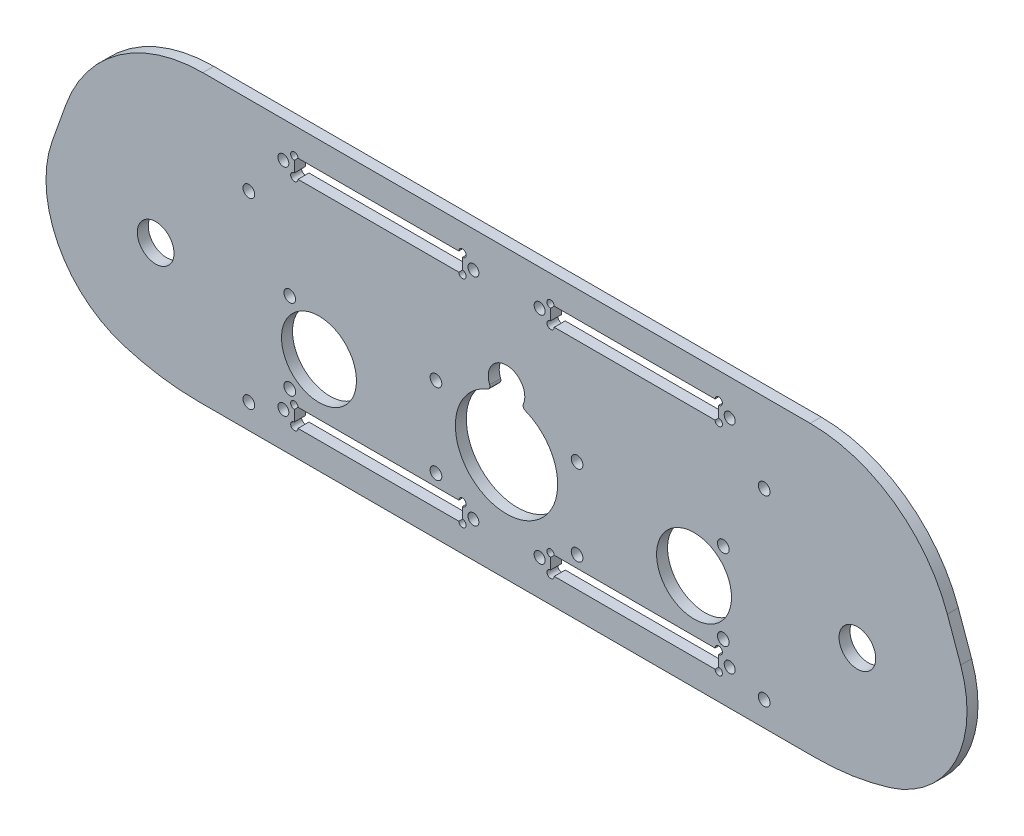
from build123d import *

# Parameters (mm, degrees)
SKETCH_1_R               = 5.025
EXTRUDE_1_DEPTH          = 3
SKETCH_2_R               = 1.6
SKETCH_2_R_2             = 10.25
SKETCH_2_R_3             = 14
CUT_EXTRUDE_1_DEPTH      = 130.55693729
EXTRUDE_START            = -3
EXTRUDE_2_DEPTH          = 3
SKETCH_3_R               = 1.5
SKETCH_3_W               = 46
SKETCH_3_H               = 5
CUT_EXTRUDE_2_DEPTH      = 135.433749111
CUT_EXTRUDE_3_DEPTH      = 135.433749111
CUT_EXTRUDE_3_DEPTH_BACK = 135.433749111
SKETCH_5_R               = 1
SKETCH_6_R               = 5
CUT_EXTRUDE_5_DEPTH      = 135.433749111
FILLET_1_R               = 1


with BuildPart() as part:
    # ｽｹｯﾁ1 → ﾎﾞｽ - 押し出し1 (new body)
    with BuildSketch(Plane.XY):
        with BuildLine():
            Line((96, -30), (-96, -30))
            ThreePointArc((-96, -30), (-126, 0), (-96, 30))
            Line((-96, 30), (96, 30))
            ThreePointArc((96, 30), (126, 0), (96, -30))
        make_face()
        with Locations((-96, 0)):
            Circle(SKETCH_1_R, mode=Mode.SUBTRACT)
        with Locations((96, 0)):
            Circle(SKETCH_1_R, mode=Mode.SUBTRACT)
    extrude(amount=EXTRUDE_1_DEPTH)

    # ｽｹｯﾁ2 → ｶｯﾄ - 押し出し1 (cut, through all)
    with BuildSketch(Plane.XY.offset(3)):
        with Locations((-59.307299254, 5.75)):
            Circle(SKETCH_2_R)
        with Locations((-59.307299254, -16.25)):
            Circle(SKETCH_2_R)
        with Locations((-19.307299254, -16.25)):
            Circle(SKETCH_2_R)
        with Locations((-19.307299254, 5.75)):
            Circle(SKETCH_2_R)
        with Locations(Location((19.307299254, 5.75, 0), (0, 0, 180))):
            Circle(SKETCH_2_R)
        with Locations(Location((19.307299254, -16.25, 0), (0, 0, 180))):
            Circle(SKETCH_2_R)
        with Locations(Location((59.307299254, 5.75, 0), (0, 0, 180))):
            Circle(SKETCH_2_R)
        with Locations(Location((59.307299254, -16.25, 0), (0, 0, 180))):
            Circle(SKETCH_2_R)
        with Locations((51.307299254, -5.25)):
            Circle(SKETCH_2_R_2)
        with Locations((-51.307299254, -5.25)):
            Circle(SKETCH_2_R_2)
        with Locations((-70.5, 25)):
            Circle(SKETCH_2_R)
        with Locations((0, -2.25)):
            Circle(SKETCH_2_R_3)
        with Locations((-70.5, -25)):
            Circle(SKETCH_2_R)
        with Locations(Location((70.5, -25, 0), (0, 0, 180))):
            Circle(SKETCH_2_R)
        with Locations(Location((70.5, 25, 0), (0, 0, 180))):
            Circle(SKETCH_2_R)
    extrude(amount=-CUT_EXTRUDE_1_DEPTH, mode=Mode.SUBTRACT)

    # ｽｹｯﾁ4 → ﾎﾞｽ - 押し出し2 (add)
    with BuildSketch(Plane.XY.offset(3).offset(EXTRUDE_START)):
        with BuildLine():
            Line((-124.26065672, 10.06654269), (-120.611311687, 20.311657664))
            ThreePointArc((-120.611311687, 20.311657664), (-106.051810297, 39.489926307), (-83.1, 46.77))
            Line((-83.1, 46.77), (83.1, 46.77))
            ThreePointArc((83.1, 46.77), (106.051810297, 39.489926307), (120.611311687, 20.311657664))
            Line((120.611311687, 20.311657664), (124.26065672, 10.06654269))
            ThreePointArc((124.26065672, 10.06654269), (113.291670239, 24.515263416), (96, 30))
            Line((96, 30), (-96, 30))
            ThreePointArc((-96, 30), (-113.291670239, 24.515263416), (-124.26065672, 10.06654269))
        make_face()
        with BuildLine():
            Line((-84.297970262, -31.75), (84.297970262, -31.75))
            ThreePointArc((84.297970262, -31.75), (94.651109882, -30.980141557), (104.776522304, -28.6875))
            ThreePointArc((104.776522304, -28.6875), (100.437059837, -29.670060667), (96, -30))
            Line((96, -30), (-96, -30))
            ThreePointArc((-96, -30), (-100.437059837, -29.670060667), (-104.776522304, -28.6875))
            ThreePointArc((-104.776522304, -28.6875), (-94.651109882, -30.980141557), (-84.297970262, -31.75))
        make_face()
    extrude(amount=EXTRUDE_2_DEPTH)

    # ｽｹｯﾁ3 → ｶｯﾄ - 押し出し2 (cut, through all)
    with BuildSketch(Plane.XY.offset(3)):
        with Locations((-61.057299254, 37.02)):
            Circle(SKETCH_3_R)
        with Locations(Location((-9.057299254, 37.02, 0), (0, 0, 180))):
            Circle(SKETCH_3_R)
        with Locations((-9.057299254, -22)):
            Circle(SKETCH_3_R)
        with Locations(Location((-61.057299254, -22, 0), (0, 0, 180))):
            Circle(SKETCH_3_R)
        with Locations((61.057299254, -22)):
            Circle(SKETCH_3_R)
        with Locations(Location((9.057299254, -22, 0), (0, 0, 180))):
            Circle(SKETCH_3_R)
        with Locations((9.057299254, 37.02)):
            Circle(SKETCH_3_R)
        with Locations(Location((61.057299254, 37.02, 0), (0, 0, 180))):
            Circle(SKETCH_3_R)
        with Locations((-35.057299254, 37.02)):
            Rectangle(SKETCH_3_W, SKETCH_3_H)
        with Locations((-35.057299254, -22)):
            Rectangle(SKETCH_3_W, SKETCH_3_H)
        with Locations((35.057299254, -22)):
            Rectangle(SKETCH_3_W, SKETCH_3_H)
        with Locations((35.057299254, 37.02)):
            Rectangle(SKETCH_3_W, SKETCH_3_H)
    extrude(amount=-CUT_EXTRUDE_2_DEPTH, mode=Mode.SUBTRACT)

    # ｽｹｯﾁ5 → ｶｯﾄ - 押し出し3 (cut, two sides: drawn at the far end of the back side and taken through both)
    with BuildSketch(Plane.XY.offset(3).offset(-CUT_EXTRUDE_3_DEPTH_BACK)):
        with Locations((-58.057299254, 39.52)):
            Circle(SKETCH_5_R)
        with Locations((-58.057299254, 34.52)):
            Circle(SKETCH_5_R)
        with Locations((-12.057299254, 39.52)):
            Circle(SKETCH_5_R)
        with Locations((-12.057299254, 34.52)):
            Circle(SKETCH_5_R)
        with Locations((12.057299254, 34.52)):
            Circle(SKETCH_5_R)
        with Locations((12.057299254, 39.52)):
            Circle(SKETCH_5_R)
        with Locations((58.057299254, 34.52)):
            Circle(SKETCH_5_R)
        with Locations((58.057299254, 39.52)):
            Circle(SKETCH_5_R)
        with Locations((58.057299254, -24.5)):
            Circle(SKETCH_5_R)
        with Locations((58.057299254, -19.5)):
            Circle(SKETCH_5_R)
        with Locations((12.057299254, -24.5)):
            Circle(SKETCH_5_R)
        with Locations((12.057299254, -19.5)):
            Circle(SKETCH_5_R)
        with Locations((-12.057299254, -19.5)):
            Circle(SKETCH_5_R)
        with Locations((-12.057299254, -24.5)):
            Circle(SKETCH_5_R)
        with Locations((-58.057299254, -19.5)):
            Circle(SKETCH_5_R)
        with Locations((-58.057299254, -24.5)):
            Circle(SKETCH_5_R)
    extrude(amount=CUT_EXTRUDE_3_DEPTH + CUT_EXTRUDE_3_DEPTH_BACK, mode=Mode.SUBTRACT)

    # ｽｹｯﾁ6 → ｶｯﾄ - 押し出し5 (cut, through all)
    with BuildSketch(Plane.XY.offset(3)):
        with Locations((0, 14)):
            Circle(SKETCH_6_R)
    extrude(amount=-CUT_EXTRUDE_5_DEPTH, mode=Mode.SUBTRACT)

    # ﾌｨﾚｯﾄ1
    fillet_1_edges = [part.edges().sort_by_distance(p)[0] for p in [
        (4.098852037, 11.136538462, 1.5),
        (-4.098852037, 11.136538462, 1.5),
    ]]
    fillet(fillet_1_edges, radius=FILLET_1_R)


solid = part.part
